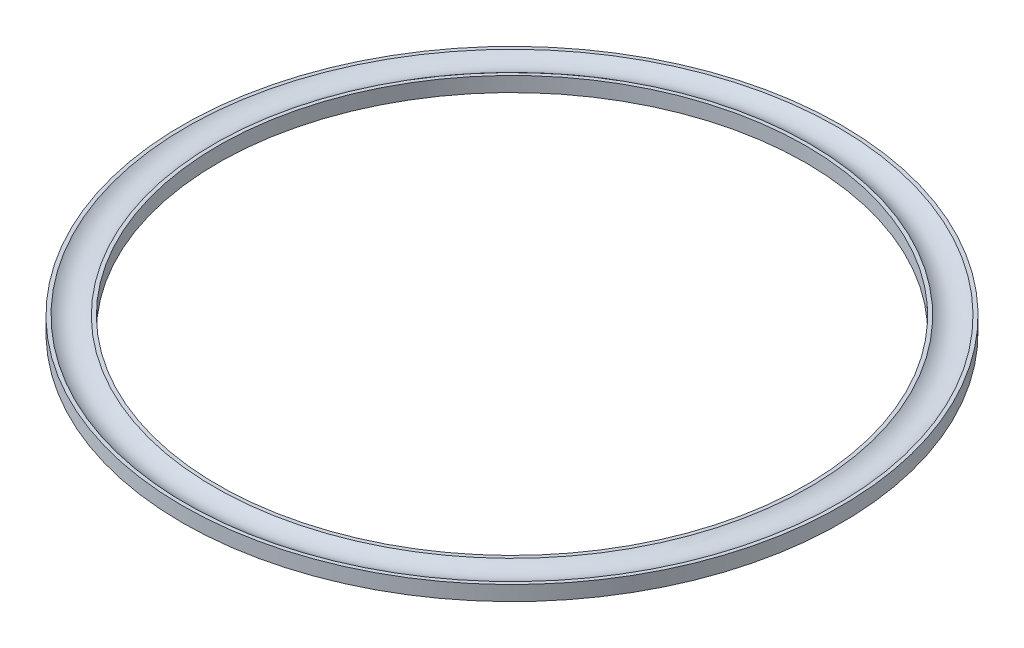
from build123d import *


with BuildPart() as part:
    # Sketch1 → Revolve2 (revolve)
    with BuildSketch(Plane.XY, mode=Mode.PRIVATE) as revolve2_sk:
        with BuildLine():
            Line((42.9768, -0.9652), (42.9768, 0.9652))
            Line((42.9768, 0.9652), (42.51198, 0.9652))
            ThreePointArc((42.51198, 0.9652), (40.6527, 0.29972), (38.79342, 0.9652))
            Line((38.79342, 0.9652), (38.3286, 0.9652))
            Line((38.3286, 0.9652), (38.3286, -0.9652))
            Line((38.3286, -0.9652), (42.9768, -0.9652))
        make_face()
    revolve(revolve2_sk.sketch.rotate(Axis((0, -11.412625366, 0), (0, 1, 0)), 90), axis=Axis((0, -11.412625366, 0), (0, 1, 0)))


solid = part.part
